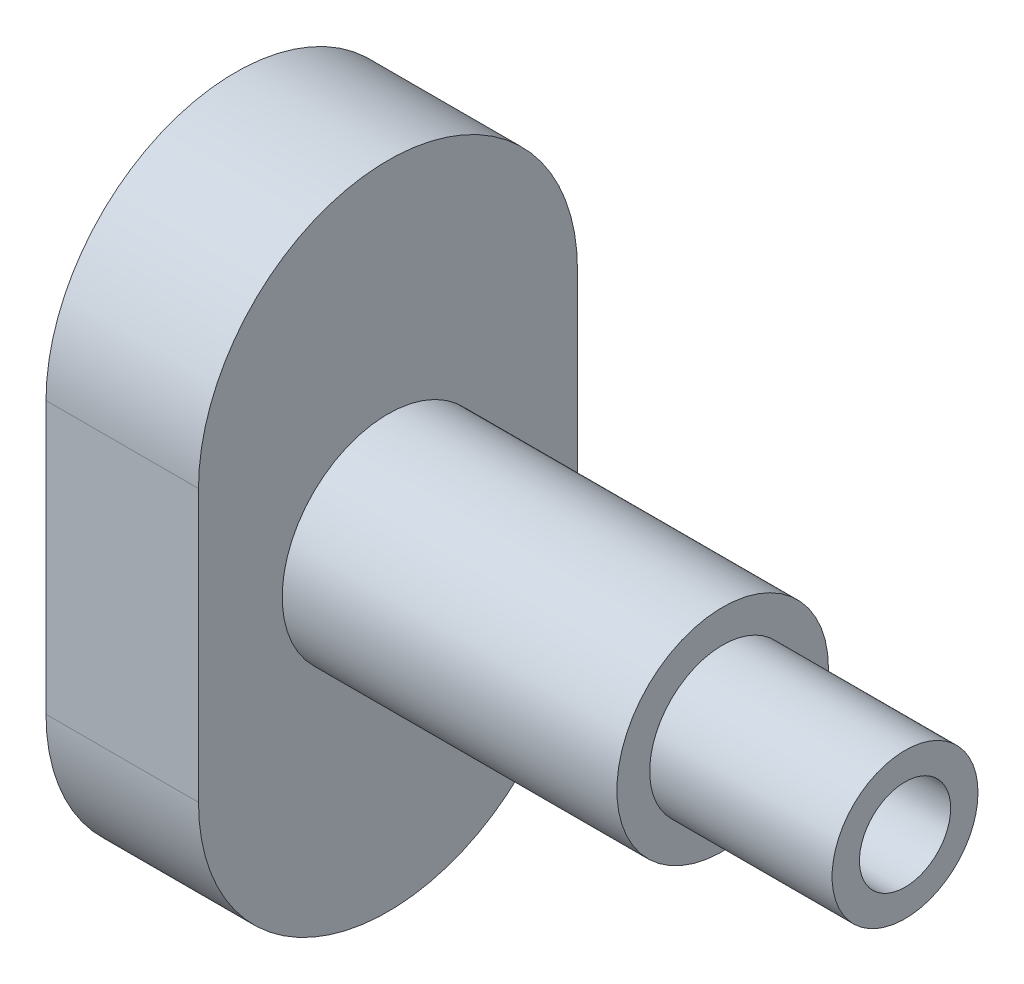
from build123d import *

# Parameters (mm, degrees)
BOSS_EXTRUDE1_DEPTH = 8.36
SKETCH2_R           = 5.8
BOSS_EXTRUDE2_DEPTH = 18.35
SKETCH3_R           = 4
BOSS_EXTRUDE3_DEPTH = 10
SKETCH4_R           = 2.5
CUT_EXTRUDE1_DEPTH  = 43.117001318


with BuildPart() as part:
    # Sketch1 → Boss-Extrude1 (new body)
    with BuildSketch(Plane.YZ):
        with BuildLine():
            Line((-7.45, 10.39), (7.45, 10.39))
            ThreePointArc((7.45, 10.39), (17.84, 0), (7.45, -10.39))
            Line((7.45, -10.39), (-7.45, -10.39))
            ThreePointArc((-7.45, -10.39), (-17.84, 0), (-7.45, 10.39))
        make_face()
    extrude(amount=BOSS_EXTRUDE1_DEPTH)

    # Sketch2 → Boss-Extrude2 (add)
    with BuildSketch(Plane.YZ.offset(8.36)):
        with Locations(Location((0, 0, 0), (0, 0, 270))):
            Circle(SKETCH2_R)
    extrude(amount=BOSS_EXTRUDE2_DEPTH)

    # Sketch3 → Boss-Extrude3 (add)
    with BuildSketch(Plane.YZ.offset(26.71)):
        with Locations(Location((0, 0, 0), (0, 0, 270))):
            Circle(SKETCH3_R)
    extrude(amount=BOSS_EXTRUDE3_DEPTH)

    # Sketch4 → Cut-Extrude1 (cut, through all)
    with BuildSketch(Plane.YZ.offset(36.71)):
        with Locations(Location((0, 0, 0), (0, 0, 270))):
            Circle(SKETCH4_R)
    extrude(amount=-CUT_EXTRUDE1_DEPTH, mode=Mode.SUBTRACT)


solid = part.part
